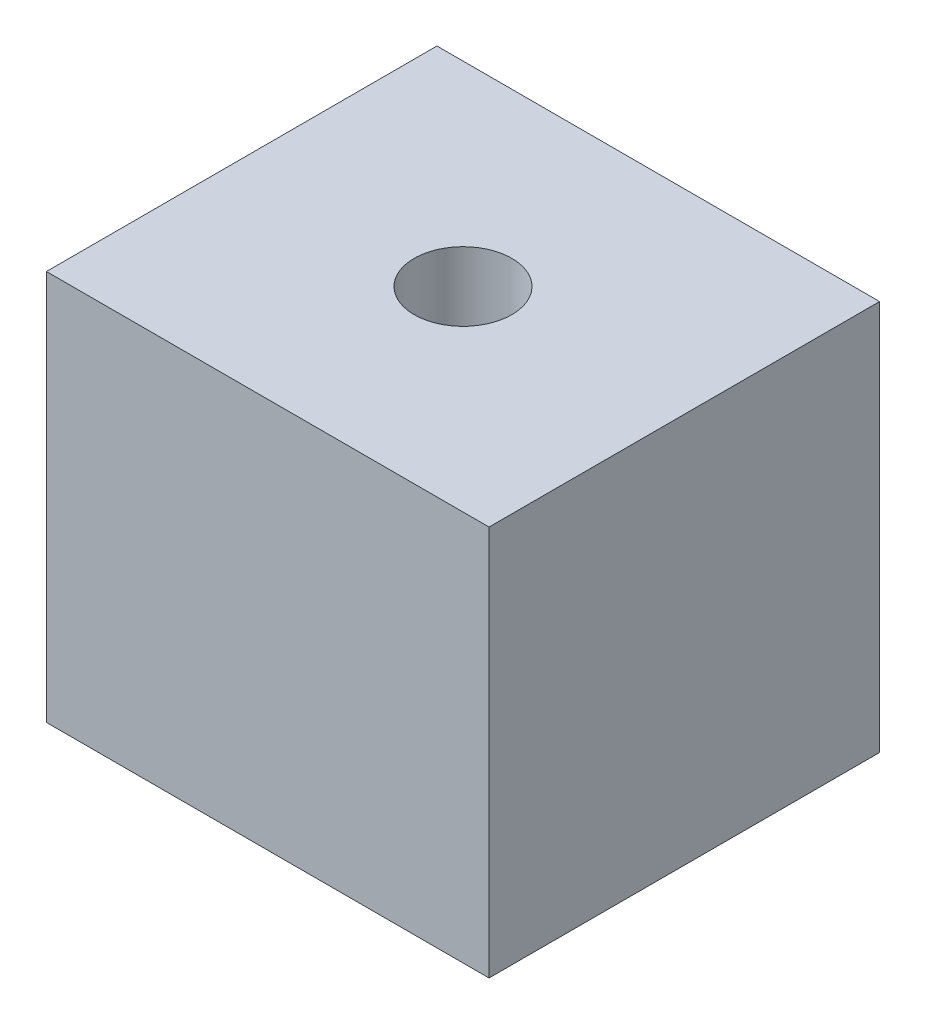
from build123d import *

# Parameters (mm, degrees)
SKETCH1_W           = 34
SKETCH1_H           = 30
SKETCH1_R           = 2
BOSS_EXTRUDE1_DEPTH = 30
SKETCH2_W           = 34
SKETCH2_H           = 30
BOSS_EXTRUDE2_DEPTH = 23
SKETCH3_R           = 3.75
CUT_EXTRUDE1_DEPTH  = 30


with BuildPart() as part:
    # Sketch1 → Boss-Extrude1 (new body)
    with BuildSketch(Plane.XY):
        with Locations((17, 15)):
            Rectangle(SKETCH1_W, SKETCH1_H)
        with Locations((4.75, 25.25)):
            Circle(SKETCH1_R, mode=Mode.SUBTRACT)
        with Locations((29.25, 25.25)):
            Circle(SKETCH1_R, mode=Mode.SUBTRACT)
        with Locations((29.25, 4.75)):
            Circle(SKETCH1_R, mode=Mode.SUBTRACT)
        with Locations((4.75, 4.75)):
            Circle(SKETCH1_R, mode=Mode.SUBTRACT)
    extrude(amount=BOSS_EXTRUDE1_DEPTH)

    # Sketch2 → Boss-Extrude2 (add)
    with BuildSketch(Plane.XY.offset(30)):
        with Locations((17, 15)):
            Rectangle(SKETCH2_W, SKETCH2_H)
    extrude(amount=-BOSS_EXTRUDE2_DEPTH)

    # Sketch3 → Cut-Extrude1 (cut)
    with BuildSketch(Plane(origin=(0, 30, 0), x_dir=(1, 0, 0), z_dir=(0, 1, 0))):
        with Locations(Location((17, -15, 0), (0, 0, 270))):
            Circle(SKETCH3_R)
    extrude(amount=-CUT_EXTRUDE1_DEPTH, mode=Mode.SUBTRACT)


solid = part.part
